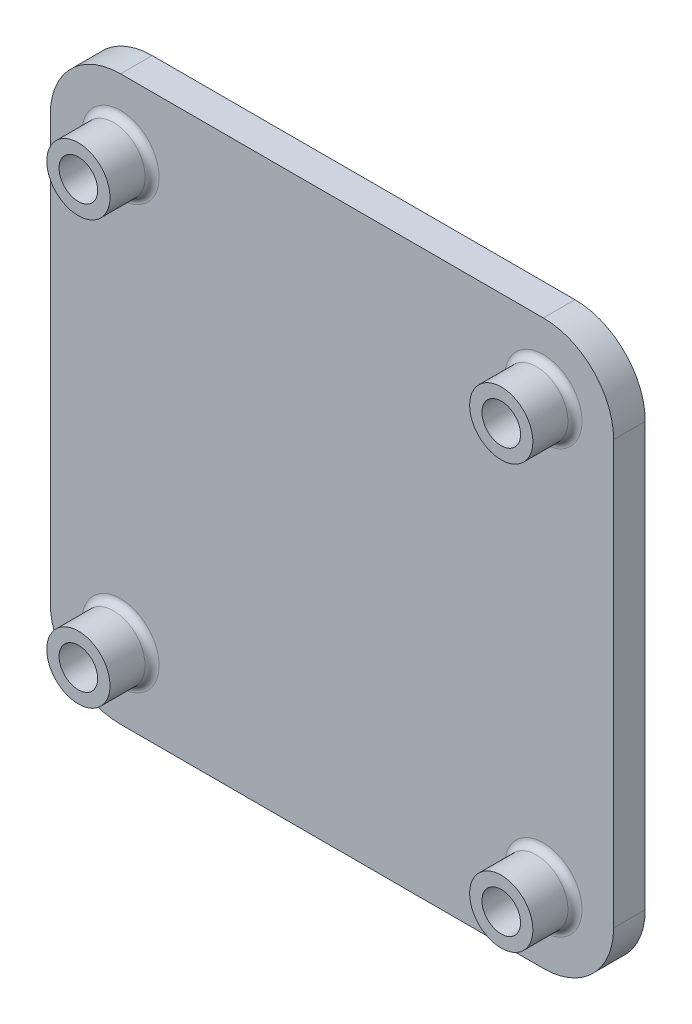
from build123d import *

# Parameters (mm, degrees)
SKETCH1_W                                  = 80.2
SKETCH1_H                                  = 80.2
BOSS_EXTRUDE1_DEPTH                        = 4.5
M5_CLEARANCE_HOLE1_D                       = 5.5
FILLET2_R                                  = 10
SKETCH3_R                                  = 4.5
BOSS_EXTRUDE2_DEPTH                        = 6
CUT_EXTRUDE1_REACH                         = 59.026
SKETCH5_R                                  = 2.75
MIRROR2_AT_THE_SECOND_PLANE_COPY_1_SKETC_R = 4.5
MIRROR2_AT_THE_SECOND_PLANE_COPY_1_DEPTH   = 6
MIRROR2_AT_THE_SECOND_PLANE_COPY_2_REACH   = 59.026
MIRROR2_AT_THE_SECOND_PLANE_COPY_2_SKETC_R = 2.75
FILLET4_R                                  = 1


with BuildPart() as part:
    # Sketch1 → Boss-Extrude1 (new body)
    with BuildSketch(Plane.XY):
        Rectangle(SKETCH1_W, SKETCH1_H)
    extrude(amount=BOSS_EXTRUDE1_DEPTH)

    # M5 Clearance Hole1 (through all)
    with Locations(Plane(origin=(-30.1, -30.1, 0), x_dir=(-1, 0, 0), z_dir=(0, 0, -1))):
        with Locations((0, 0), (-60.2, 60.2), (0, 60.2), (-60.2, 0)):
            Hole(M5_CLEARANCE_HOLE1_D / 2)

    # Fillet2
    fillet2_edges = [part.edges().sort_by_distance(p)[0] for p in [
        (40.1, -40.1, 2.25),
        (-40.1, -40.1, 2.25),
        (-40.1, 40.1, 2.25),
        (40.1, 40.1, 2.25),
    ]]
    fillet(fillet2_edges, radius=FILLET2_R)

    # Sketch3 → Boss-Extrude2 (add)
    with BuildSketch(Plane.XY.offset(4.5)):
        with Locations(Location((-30.1, 30.1, 0), (0, 0, 180))):
            Circle(SKETCH3_R)
    boss_extrude2 = extrude(amount=BOSS_EXTRUDE2_DEPTH)

    # Sketch5 → Cut-Extrude1 (cut, up to next)
    with BuildSketch(Plane(origin=(0, 0, 4.5), x_dir=(-1, 0, 0), z_dir=(0, 0, -1)), mode=Mode.PRIVATE) as cut_extrude1_sk1:
        with Locations((30.1, 30.1)):
            Circle(SKETCH5_R)
    cut_extrude1_tool1 = extrude(cut_extrude1_sk1.sketch, amount=-CUT_EXTRUDE1_REACH, mode=Mode.PRIVATE) & part.part
    cut_extrude1 = cut_extrude1_tool1.solids().sort_by_distance((-30.1, 30.1, 4.5))[0]
    add(cut_extrude1, mode=Mode.SUBTRACT)

    # Mirror2: Boss-Extrude2, Cut-Extrude1 across plane
    add(boss_extrude2.mirror(Plane.ZX))
    add(cut_extrude1.mirror(Plane.ZX), mode=Mode.SUBTRACT)

    # Mirror2 at the second plane: Boss-Extrude2, Cut-Extrude1 across plane
    add(boss_extrude2.mirror(Plane(origin=(0, 0, 0), x_dir=(0, 0, 1), z_dir=(1, 0, 0))))
    add(cut_extrude1.mirror(Plane(origin=(0, 0, 0), x_dir=(0, 0, 1), z_dir=(1, 0, 0))), mode=Mode.SUBTRACT)

    # Mirror2 at the second plane copy 1 sketc → Mirror2 at the second plane copy 1 (add)
    with BuildSketch(Plane(origin=(0, 0, 4.5), x_dir=(-1, 0, 0), z_dir=(0, 0, 1))):
        with Locations(Location((-30.1, 30.1, 0), (0, 0, 180))):
            Circle(MIRROR2_AT_THE_SECOND_PLANE_COPY_1_SKETC_R)
    extrude(amount=MIRROR2_AT_THE_SECOND_PLANE_COPY_1_DEPTH)

    # Mirror2 at the second plane copy 2 sketc → Mirror2 at the second plane copy 2 (cut, up to next)
    with BuildSketch(Plane(origin=(0, 0, 4.5), x_dir=(1, 0, 0), z_dir=(0, 0, -1)), mode=Mode.PRIVATE) as mirror2_at_the_second_plane_copy_2_sk1:
        with Locations((30.1, 30.1)):
            Circle(MIRROR2_AT_THE_SECOND_PLANE_COPY_2_SKETC_R)
    mirror2_at_the_second_plane_copy_2_tool1 = extrude(mirror2_at_the_second_plane_copy_2_sk1.sketch, amount=-MIRROR2_AT_THE_SECOND_PLANE_COPY_2_REACH, mode=Mode.PRIVATE) & part.part
    add(mirror2_at_the_second_plane_copy_2_tool1.solids().sort_by_distance((30.1, -30.1, 4.5))[0], mode=Mode.SUBTRACT)

    # Fillet4
    fillet4_edges = [part.edges().sort_by_distance(p)[0] for p in [
        (-25.6, 30.1, 4.5),
        (25.6, 30.1, 4.5),
        (-25.6, -30.1, 4.5),
        (25.6, -30.1, 4.5),
    ]]
    fillet(fillet4_edges, radius=FILLET4_R)


solid = part.part
